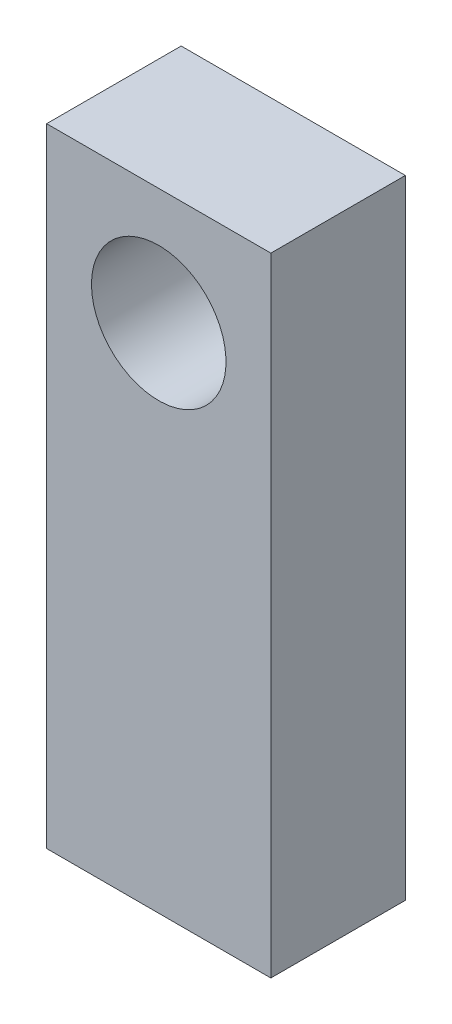
from build123d import *

# Parameters (mm, degrees)
SKETCH1_W           = 12.7
SKETCH1_H           = 35.56
SKETCH1_R           = 3.81
BOSS_EXTRUDE1_DEPTH = 7.62


with BuildPart() as part:
    # Sketch1 → Boss-Extrude1 (new body)
    with BuildSketch(Plane.XY):
        with Locations((0, -11.176)):
            Rectangle(SKETCH1_W, SKETCH1_H)
        with Locations(Location((0, 0, 0), (0, 0, 180))):
            Circle(SKETCH1_R, mode=Mode.SUBTRACT)
    extrude(amount=BOSS_EXTRUDE1_DEPTH)


solid = part.part
